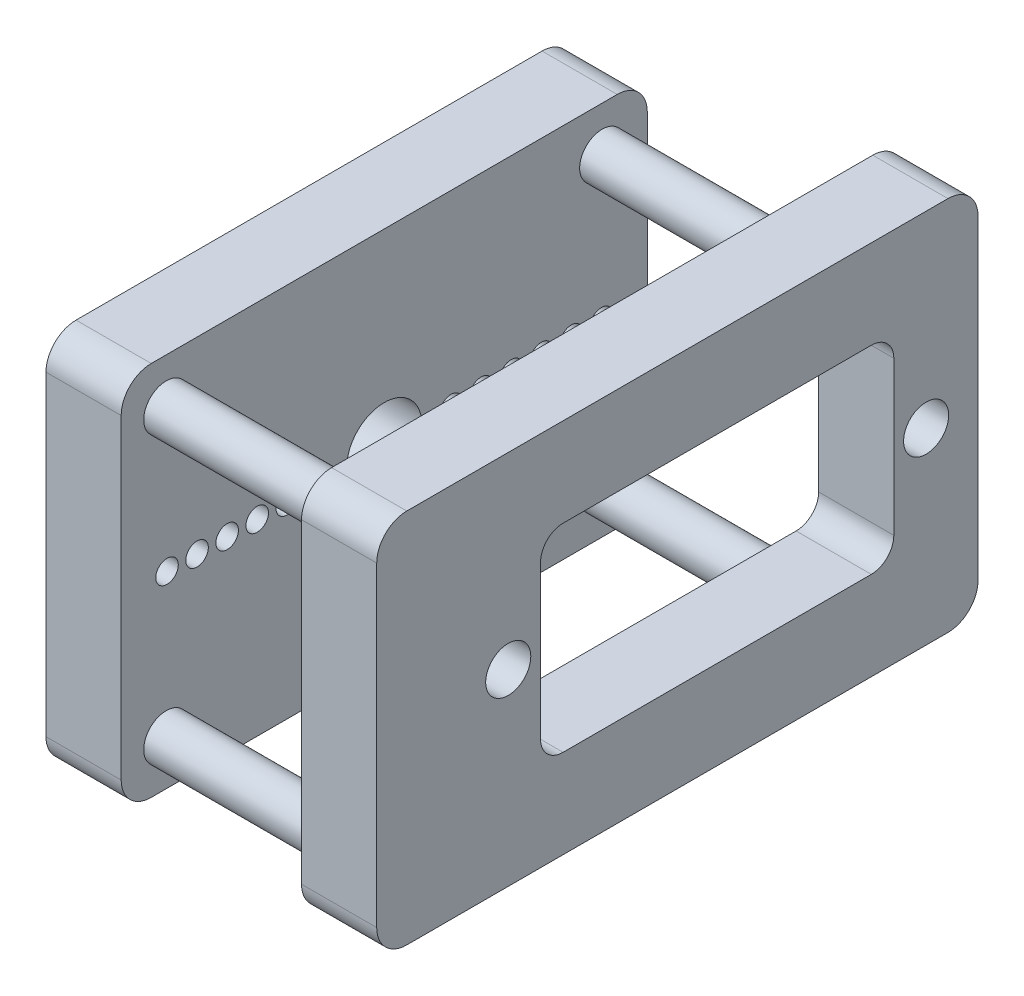
from build123d import *

# Parameters (mm, degrees)
SKETCH1_W           = 35
SKETCH1_H           = 25
SKETCH1_R           = 0.75
SKETCH1_R_2         = 2.5
BOSS_EXTRUDE1_DEPTH = 5
SKETCH5_R           = 1.5
BOSS_EXTRUDE3_DEPTH = 12
SKETCH4_W           = 25
SKETCH4_H           = 40
BOSS_EXTRUDE2_DEPTH = 5
CUT_EXTRUDE2_REACH  = 55.819
SKETCH3_R           = 1.5
SKETCH3_W           = 13.2
SKETCH3_H           = 23.5
FILLET5_R           = 1.5
FILLET6_R           = 2


with BuildPart() as part:
    # Sketch1 → Boss-Extrude1 (new body)
    with BuildSketch(Plane(origin=(0, 0, 0), x_dir=(0, 0, -1), z_dir=(1, 0, 0))):
        Rectangle(SKETCH1_W, SKETCH1_H)
        with Locations((-14.45, 0)):
            Circle(SKETCH1_R, mode=Mode.SUBTRACT)
        with Locations((-12.45, 0)):
            Circle(SKETCH1_R, mode=Mode.SUBTRACT)
        with Locations((-10.45, 0)):
            Circle(SKETCH1_R, mode=Mode.SUBTRACT)
        with Locations((-8.45, 0)):
            Circle(SKETCH1_R, mode=Mode.SUBTRACT)
        with Locations((-6.45, 0)):
            Circle(SKETCH1_R, mode=Mode.SUBTRACT)
        with Locations((-4.45, 0)):
            Circle(SKETCH1_R, mode=Mode.SUBTRACT)
        Circle(SKETCH1_R_2, mode=Mode.SUBTRACT)
        with Locations((4.45, 0)):
            Circle(SKETCH1_R, mode=Mode.SUBTRACT)
        with Locations((6.45, 0)):
            Circle(SKETCH1_R, mode=Mode.SUBTRACT)
        with Locations((8.45, 0)):
            Circle(SKETCH1_R, mode=Mode.SUBTRACT)
        with Locations((10.45, 0)):
            Circle(SKETCH1_R, mode=Mode.SUBTRACT)
        with Locations((12.45, 0)):
            Circle(SKETCH1_R, mode=Mode.SUBTRACT)
        with Locations((14.45, 0)):
            Circle(SKETCH1_R, mode=Mode.SUBTRACT)
    extrude(amount=BOSS_EXTRUDE1_DEPTH)

    # Sketch5 → Boss-Extrude3 (add)
    with BuildSketch(Plane(origin=(5, 0, 0), x_dir=(0, 0, -1), z_dir=(1, 0, 0))):
        with Locations((-14.5, 9.5)):
            Circle(SKETCH5_R)
        with Locations((14.5, 9.5)):
            Circle(SKETCH5_R)
        with Locations((14.5, -9.5)):
            Circle(SKETCH5_R)
        with Locations((-14.5, -9.5)):
            Circle(SKETCH5_R)
    extrude(amount=BOSS_EXTRUDE3_DEPTH)

    # Sketch4 → Boss-Extrude2 (add)
    with BuildSketch(Plane(origin=(17, 17.5, 0), x_dir=(0, -1, 0), z_dir=(1, 0, 0))):
        with Locations((17.5, 2.5)):
            Rectangle(SKETCH4_W, SKETCH4_H)
    extrude(amount=BOSS_EXTRUDE2_DEPTH)

    # Sketch3 → Cut-Extrude2 (cut, up to next)
    with BuildSketch(Plane(origin=(22, 0, -30), x_dir=(0, 1, 0), z_dir=(1, 0, 0)), mode=Mode.PRIVATE) as cut_extrude2_sk1:
        with Locations((0, 38.75)):
            Circle(SKETCH3_R)
    cut_extrude2_tool1 = extrude(cut_extrude2_sk1.sketch, amount=-CUT_EXTRUDE2_REACH, mode=Mode.PRIVATE) & part.part
    # Sketch3 → Cut-Extrude2 (cut, up to next)
    with BuildSketch(Plane(origin=(22, 0, -30), x_dir=(0, 1, 0), z_dir=(1, 0, 0)), mode=Mode.PRIVATE) as cut_extrude2_sk2:
        with Locations((0, 10.95)):
            Circle(SKETCH3_R)
    cut_extrude2_tool2 = extrude(cut_extrude2_sk2.sketch, amount=-CUT_EXTRUDE2_REACH, mode=Mode.PRIVATE) & part.part
    # Sketch3 → Cut-Extrude2 (cut, up to next)
    with BuildSketch(Plane(origin=(22, 0, -30), x_dir=(0, 1, 0), z_dir=(1, 0, 0)), mode=Mode.PRIVATE) as cut_extrude2_sk3:
        with Locations((0, 24.85)):
            Rectangle(SKETCH3_W, SKETCH3_H)
    cut_extrude2_tool3 = extrude(cut_extrude2_sk3.sketch, amount=-CUT_EXTRUDE2_REACH, mode=Mode.PRIVATE) & part.part
    add(cut_extrude2_tool1.solids().sort_by_distance((22, 0, 8.75))[0], mode=Mode.SUBTRACT)
    add(cut_extrude2_tool2.solids().sort_by_distance((22, 0, -19.05))[0], mode=Mode.SUBTRACT)
    add(cut_extrude2_tool3.solids().sort_by_distance((22, 0, -5.15))[0], mode=Mode.SUBTRACT)

    # Fillet5
    fillet5_edges = [part.edges().sort_by_distance(p)[0] for p in [
        (19.5, 6.6, 6.6),
        (19.5, 6.6, -16.9),
        (19.5, -6.6, -16.9),
        (19.5, -6.6, 6.6),
    ]]
    fillet(fillet5_edges, radius=FILLET5_R)

    # Fillet6
    fillet6_edges = [part.edges().sort_by_distance(p)[0] for p in [
        (19.5, -12.5, 17.5),
        (19.5, 12.5, -22.5),
        (19.5, -12.5, -22.5),
        (2.5, -12.5, -17.5),
        (2.5, 12.5, -17.5),
        (2.5, -12.5, 17.5),
        (2.5, 12.5, 17.5),
        (19.5, 12.5, 17.5),
    ]]
    fillet(fillet6_edges, radius=FILLET6_R)


solid = part.part
